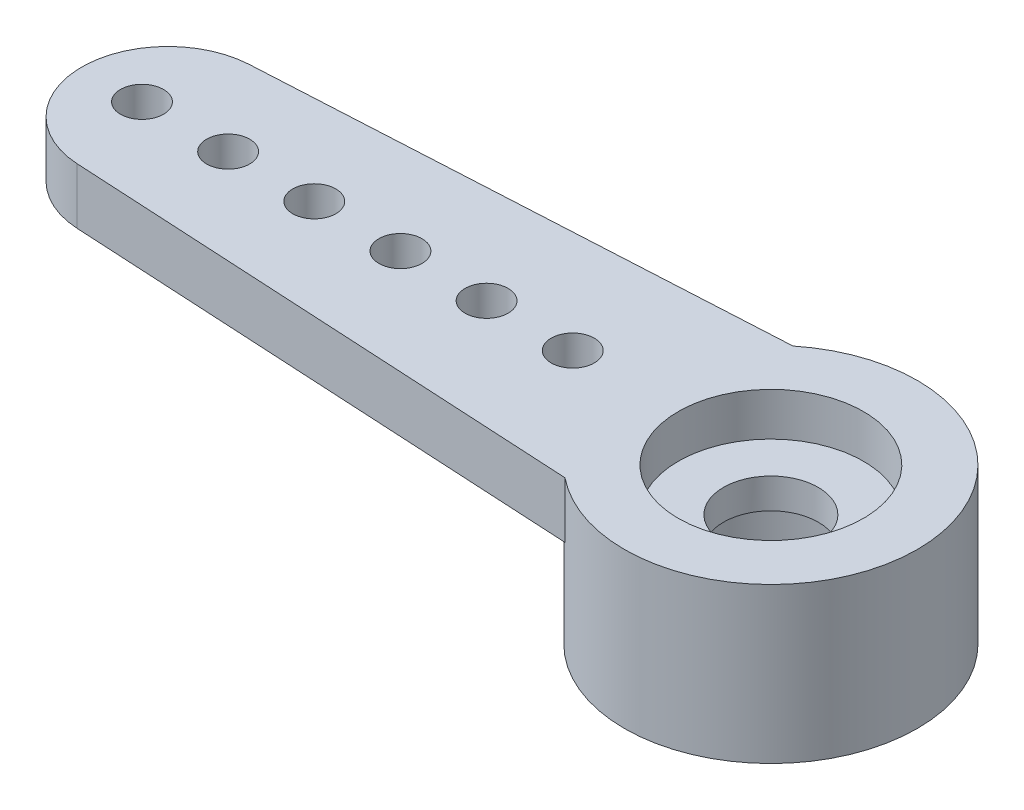
from build123d import *

# Parameters (mm, degrees)
SKETCH1_R           = 0.5
SKETCH1_R_2         = 1.1
BOSS_EXTRUDE1_DEPTH = 1.3
SKETCH3_R           = 2.15
CUT_EXTRUDE1_DEPTH  = 1
SKETCH4_R           = 3.4
BOSS_EXTRUDE3_DEPTH = 2.3
SKETCH5_R           = 2.35
CUT_EXTRUDE2_DEPTH  = 1.9
CUT_EXTRUDE3_REACH  = 15.77
SKETCH6_R           = 1.1


with BuildPart() as part:
    # Sketch1 → Boss-Extrude1 (new body)
    with BuildSketch(Plane(origin=(0, 0, 0), x_dir=(1, 0, 0), z_dir=(0, 1, 0))):
        with BuildLine():
            Line((3.766745444, 8.319988196), (-8.208470762, 7.669550455))
            ThreePointArc((-8.208470762, 7.669550455), (-10.1, 5.672494098), (-8.208470762, 3.675437741))
            Line((-8.208470762, 3.675437741), (3.766745444, 3.025))
            ThreePointArc((3.766745444, 3.025), (9.3, 5.672494098), (3.766745444, 8.319988196))
        make_face()
        with Locations(Location((-8.7, 5.672494098, 0), (0, 0, 270))):
            Circle(SKETCH1_R, mode=Mode.SUBTRACT)
        with Locations(Location((1.3, 5.672494098, 0), (0, 0, 270))):
            Circle(SKETCH1_R, mode=Mode.SUBTRACT)
        with Locations(Location((-0.7, 5.672494098, 0), (0, 0, 270))):
            Circle(SKETCH1_R, mode=Mode.SUBTRACT)
        with Locations(Location((-2.7, 5.672494098, 0), (0, 0, 270))):
            Circle(SKETCH1_R, mode=Mode.SUBTRACT)
        with Locations(Location((-4.7, 5.672494098, 0), (0, 0, 270))):
            Circle(SKETCH1_R, mode=Mode.SUBTRACT)
        with Locations(Location((-6.7, 5.672494098, 0), (0, 0, 270))):
            Circle(SKETCH1_R, mode=Mode.SUBTRACT)
        with Locations(Location((5.9, 5.672494098, 0), (0, 0, 270))):
            Circle(SKETCH1_R_2, mode=Mode.SUBTRACT)
    extrude(amount=-BOSS_EXTRUDE1_DEPTH)

    # Sketch3 → Cut-Extrude1 (cut)
    with BuildSketch(Plane(origin=(0, 0, 0), x_dir=(1, 0, 0), z_dir=(0, 1, 0))):
        with Locations(Location((5.9, 5.672494098, 0), (0, 0, 270))):
            Circle(SKETCH3_R)
    extrude(amount=-CUT_EXTRUDE1_DEPTH, mode=Mode.SUBTRACT)

    # Sketch4 → Boss-Extrude3 (add)
    with BuildSketch(Plane.XZ.offset(1.3)):
        with Locations(Location((5.9, -5.672494098, 0), (0, 0, 90))):
            Circle(SKETCH4_R)
    extrude(amount=BOSS_EXTRUDE3_DEPTH)

    # Sketch5 → Cut-Extrude2 (cut)
    with BuildSketch(Plane.XZ.offset(3.6)):
        with Locations(Location((5.9, -5.672494098, 0), (0, 0, 270))):
            Circle(SKETCH5_R)
    extrude(amount=-CUT_EXTRUDE2_DEPTH, mode=Mode.SUBTRACT)

    # Sketch6 → Cut-Extrude3 (cut, up to next)
    with BuildSketch(Plane(origin=(0, -1.3, 0), x_dir=(1, 0, 0), z_dir=(0, 1, 0)), mode=Mode.PRIVATE) as cut_extrude3_sk1:
        with Locations(Location((5.9, 5.672494098, 0), (0, 0, 270))):
            Circle(SKETCH6_R)
    cut_extrude3_tool1 = extrude(cut_extrude3_sk1.sketch, amount=-CUT_EXTRUDE3_REACH, mode=Mode.PRIVATE) & part.part
    add(cut_extrude3_tool1.solids().sort_by_distance((5.9, -1.3, -5.672494))[0], mode=Mode.SUBTRACT)


solid = part.part
